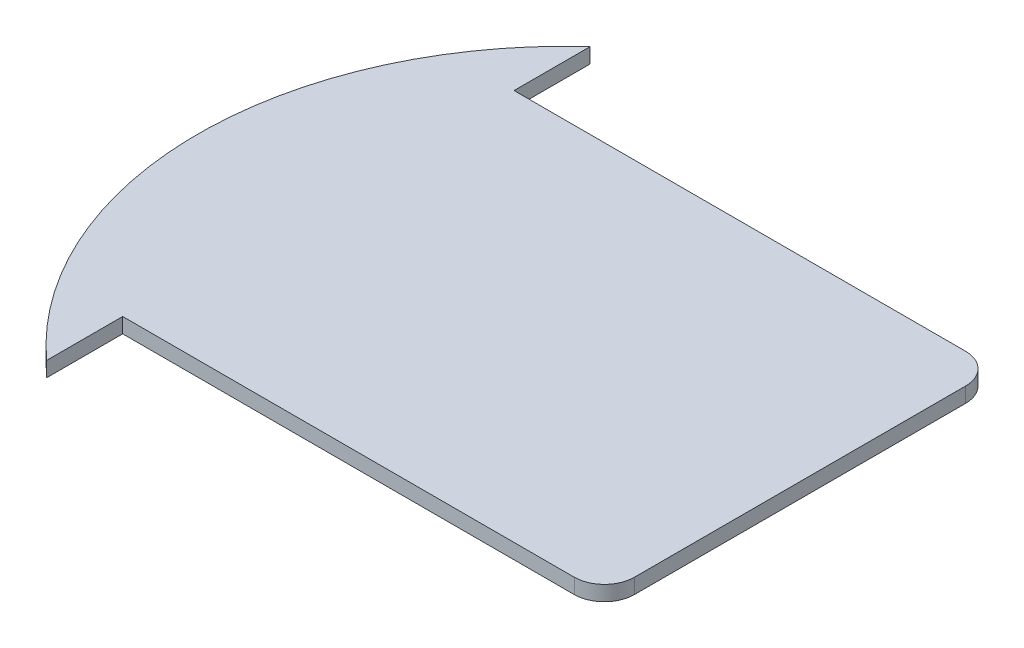
from build123d import *

# Parameters (mm, degrees)
BOSS_EXTRUDE1_DEPTH = 5
FILLET1_R           = 10


with BuildPart() as part:
    # Sketch1 → Boss-Extrude1 (new body)
    with BuildSketch(Plane(origin=(0, 0, 0), x_dir=(1, 0, 0), z_dir=(0, 1, 0))):
        with BuildLine():
            Line((40.301843205, 25), (110.301843205, 25))
            Line((110.301843205, 25), (200.301843205, 25))
            Line((200.301843205, 25), (200.301843205, 155))
            Line((200.301843205, 155), (110.301843205, 155))
            Line((110.301843205, 155), (40.301843205, 155))
            Line((40.301843205, 155), (40.301843205, 180.27466017))
            ThreePointArc((40.301843205, 180.27466017), (0.301843205, 90), (40.301843205, -0.27466017))
            Line((40.301843205, -0.27466017), (40.301843205, 25))
        make_face()
    extrude(amount=BOSS_EXTRUDE1_DEPTH)

    # Fillet1
    fillet1_edges = [part.edges().sort_by_distance(p)[0] for p in [
        (200.301843205, 2.5, -155),
        (200.301843205, 2.5, -25),
    ]]
    fillet(fillet1_edges, radius=FILLET1_R)


solid = part.part
